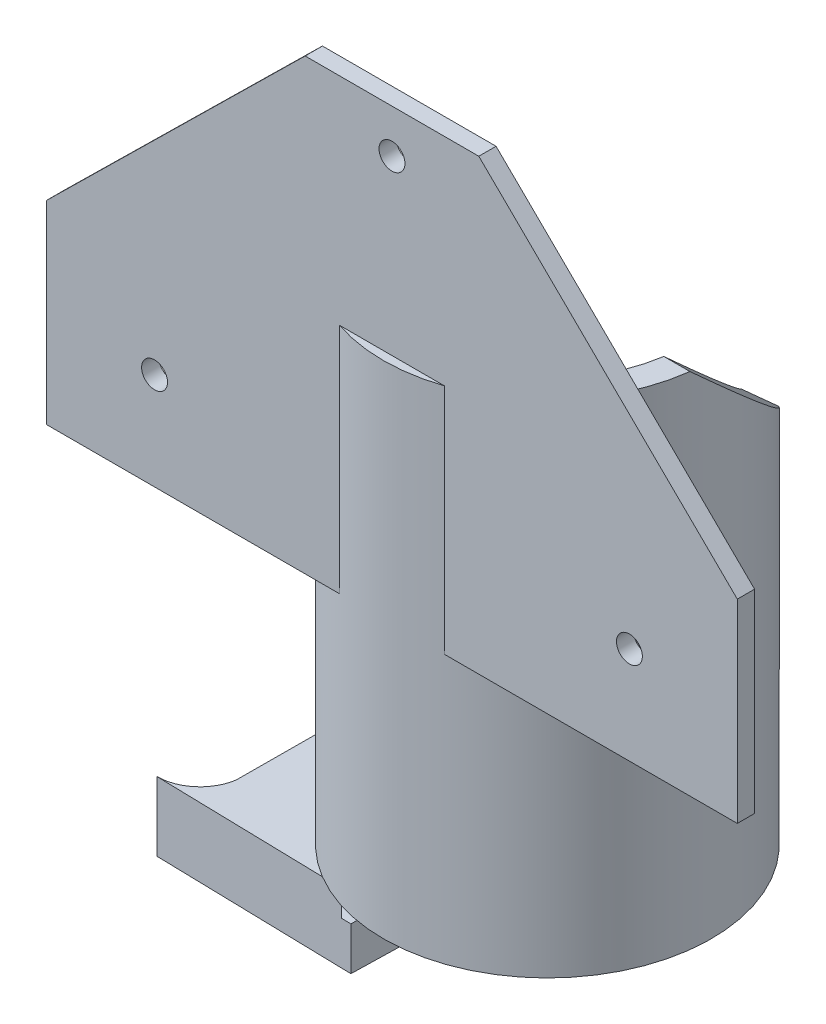
from build123d import *

# Parameters (mm, degrees)
BOSS_EXTRUDE1_DEPTH      = 53
BOSS_EXTRUDE1_DEPTH_BACK = 5
SKETCH1_R                = 19
SKETCH2_R                = 16
CUT_EXTRUDE1_DEPTH       = 22
SKETCH3_W                = 25
SKETCH3_H                = 20
CUT_EXTRUDE2_DEPTH       = 108
CUT_EXTRUDE3_DEPTH       = 108
CUT_EXTRUDE3_DEPTH_BACK  = 108
BOSS_EXTRUDE2_DEPTH      = 2
SKETCH10_R               = 1.5
CUT_EXTRUDE4_DEPTH       = 16
BOSS_EXTRUDE3_DEPTH      = 8
BOSS_EXTRUDE5_DEPTH      = 18
BOSS_EXTRUDE5_DEPTH_BACK = 4
SKETCH13_R               = 1.500172947
BOSS_EXTRUDE6_DEPTH      = 8
SKETCH15_R               = 18
CUT_EXTRUDE5_DEPTH       = 39


with BuildPart() as part:
    # Sketch1 → Boss-Extrude1 (new, two sides: drawn at the far end of the back side and taken through both)
    with BuildSketch(Plane(origin=(0, 0, 0), x_dir=(1, 0, 0), z_dir=(0, 1, 0)).offset(-BOSS_EXTRUDE1_DEPTH_BACK)):
        with Locations(Location((0, 0, 0), (0, 0, 270))):
            Circle(SKETCH1_R)
    extrude(amount=BOSS_EXTRUDE1_DEPTH + BOSS_EXTRUDE1_DEPTH_BACK)

    # Sketch2 → Cut-Extrude1 (cut)
    with BuildSketch(Plane(origin=(0, 53, 0), x_dir=(1, 0, 0), z_dir=(0, 1, 0))):
        with Locations(Location((0, 0, 0), (0, 0, 270))):
            Circle(SKETCH2_R)
    extrude(amount=-CUT_EXTRUDE1_DEPTH, mode=Mode.SUBTRACT)

    # Sketch3 → Cut-Extrude2 (cut)
    with BuildSketch(Plane(origin=(0, 53, 0), x_dir=(1, 0, 0), z_dir=(0, 1, 0))):
        with Locations((0, 16)):
            Rectangle(SKETCH3_W, SKETCH3_H)
    extrude(amount=-CUT_EXTRUDE2_DEPTH, mode=Mode.SUBTRACT)

    # Sketch7 → Cut-Extrude3 (cut, two sides: drawn at the far end of the back side and taken through both)
    with BuildSketch(Plane(origin=(0, 0, 0), x_dir=(0, 0, -1), z_dir=(1, 0, 0)).offset(-CUT_EXTRUDE3_DEPTH_BACK)):
        Polygon((14.309088021, 53), (14.309088021, 38), (-2.345455989, 53), align=None)
    extrude(amount=CUT_EXTRUDE3_DEPTH + CUT_EXTRUDE3_DEPTH_BACK, mode=Mode.SUBTRACT)

    # Sketch8 → Boss-Extrude2 (add)
    with BuildSketch(Plane.XY.offset(18)):
        Polygon((10.05709572, 78.023156751), (40, 48.571119754), (40, 26.071119754), (0, 26.071119754), (-40, 26.071119754), (-40, 48.571119754), (-10.05709572, 78.023156751), align=None)
    extrude(amount=-BOSS_EXTRUDE2_DEPTH)

    # Sketch10 → Cut-Extrude4 (cut)
    with BuildSketch(Plane(origin=(0, 0, 16), x_dir=(-1, 0, 0), z_dir=(0, 0, -1))):
        with Locations((-27.5, 37.321119754)):
            Circle(SKETCH10_R)
        with Locations((27.5, 37.321119754)):
            Circle(SKETCH10_R)
        with Locations((0, 73)):
            Circle(SKETCH10_R)
    extrude(amount=-CUT_EXTRUDE4_DEPTH, mode=Mode.SUBTRACT)

    # Sketch11 → Boss-Extrude3 (add)
    with BuildSketch(Plane.XZ.offset(5)):
        with BuildLine():
            Line((-6.390882144, -8.863379027), (-6.480237612, -11.760990645))
            ThreePointArc((-6.480237612, -11.760990645), (-7.33967567, -12.860163004), (-8.724622378, -13.029680754))
            ThreePointArc((-8.724622378, -13.029680754), (-13.107641391, -18.70255332), (-9.931897769, -25.129604841))
            ThreePointArc((-9.931897769, -25.129604841), (-9.756819698, -26.038761874), (-10.275891909, -26.805431868))
            Line((-10.275891909, -26.805431868), (-18.890882144, -26.863380934))
            Line((-18.890882144, -26.863380934), (-18.890882144, -23.863377119))
            Line((-18.890882144, -23.863377119), (-28.890882144, -23.863377119))
            Line((-28.890882144, -23.863377119), (-28.890882144, -16.863377119))
            Line((-28.890882144, -16.863377119), (-31.890882144, -16.863377119))
            ThreePointArc((-31.890882144, -16.863377119), (-29.928759086, -7.76088478), (-24.390882144, -0.275084044))
            Line((-24.390882144, -0.275084044), (-24.452405581, 11.618795847))
            ThreePointArc((-24.452405581, 11.618795847), (-26.143620347, 14.638664645), (-29.390882144, 15.836623644))
            Line((-29.390882144, 15.836623644), (-6.375618396, 16.386397999))
            Line((-6.375618396, 16.386397999), (-6.012446141, 1.182878311))
            Line((-6.012446141, 1.182878311), (-6.390882144, -8.863379027))
        make_face()
    extrude(amount=BOSS_EXTRUDE3_DEPTH)

    # Sketch15 → Cut-Extrude5 (cut)
    with BuildSketch(Plane(origin=(0, 31, 0), x_dir=(1, 0, 0), z_dir=(0, 1, 0))):
        Circle(SKETCH15_R)
    extrude(amount=-CUT_EXTRUDE5_DEPTH, mode=Mode.SUBTRACT)


with BuildPart() as body_2:
    # Sketch12 → Boss-Extrude5 (new, two sides: drawn at the far end of the back side and taken through both)
    with BuildSketch(Plane.XZ.offset(13).offset(-BOSS_EXTRUDE5_DEPTH_BACK)):
        Polygon((-31.890882144, -26.863380934), (-18.890882144, -26.863380934), (-18.890882144, -23.863377119), (-28.890882144, -23.863377119), (-28.890882144, -16.863377119), (-31.890882144, -16.863377119), align=None)
    extrude(amount=BOSS_EXTRUDE5_DEPTH + BOSS_EXTRUDE5_DEPTH_BACK)

    # Sketch13 → Boss-Extrude6 (add)
    with BuildSketch(Plane.XZ.offset(31)):
        Polygon((-44.322698898, -26.807587047), (-18.822698898, -26.807587047), (-18.822698898, -23.807583233), (-28.822698898, -23.807583233), (-28.822698898, -16.807583233), (-44.322698898, -16.807583233), align=None)
        with Locations(Location((-39.936045011, -19.607691517, 0), (0, 0, 90))):
            Circle(SKETCH13_R, mode=Mode.SUBTRACT)
    extrude(amount=BOSS_EXTRUDE6_DEPTH)


solid = Compound([part.part, body_2.part])
